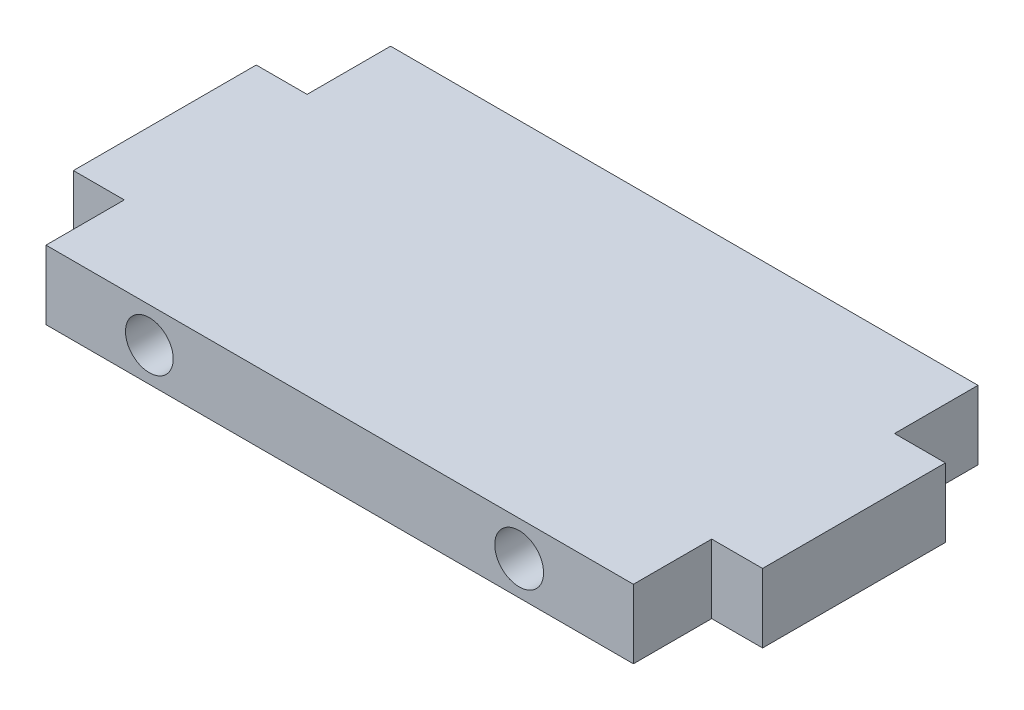
from build123d import *

# Parameters (mm, degrees)
BOSS_EXTRUDE1_DEPTH = 20.32
SKETCH3_W           = 23.583471357
SKETCH3_H           = 24.613240303
SKETCH3_H_2         = 23.081850847
SKETCH3_W_2         = 25.880555541
CUT_EXTRUDE1_DEPTH  = 120.044088604
SKETCH4_R           = 7.199159396
CUT_EXTRUDE2_DEPTH  = 147.168727436
SKETCH5_R           = 7.199159396
SKETCH5_R_2         = 7.039396065
CUT_EXTRUDE4_DEPTH  = 147.168727436


with BuildPart() as part:
    # Sketch2 → Boss-Extrude1 (new body)
    with BuildSketch(Plane(origin=(0, 0, 0), x_dir=(1, 0, 0), z_dir=(0, 1, 0))):
        with BuildLine():
            Line((-85.098911353, 55.935303266), (88.101088647, 55.935303266))
            ThreePointArc((88.101088647, 55.935303266), (98.707690365, 51.541904984), (103.101088647, 40.935303266))
            Line((103.101088647, 40.935303266), (103.101088647, -30.664696734))
            ThreePointArc((103.101088647, -30.664696734), (98.707690365, -41.271298452), (88.101088647, -45.664696734))
            Line((88.101088647, -45.664696734), (-85.098911353, -45.664696734))
            ThreePointArc((-85.098911353, -45.664696734), (-95.705513071, -41.271298452), (-100.098911353, -30.664696734))
            Line((-100.098911353, -30.664696734), (-100.098911353, 40.935303266))
            ThreePointArc((-100.098911353, 40.935303266), (-95.705513071, 51.541904984), (-85.098911353, 55.935303266))
        make_face()
    extrude(amount=-BOSS_EXTRUDE1_DEPTH)

    # Sketch3 → Cut-Extrude1 (cut, through all)
    with BuildSketch(Plane(origin=(0, 0, 0), x_dir=(1, 0, 0), z_dir=(0, 1, 0))):
        with Locations((99.892824326, 43.628683115)):
            Rectangle(SKETCH3_W, SKETCH3_H)
        with Locations((99.892824326, -34.123771311)):
            Rectangle(SKETCH3_W, SKETCH3_H_2)
        with Locations((-98.039189124, 43.628683115)):
            Rectangle(SKETCH3_W_2, SKETCH3_H)
        with Locations((-98.039189124, -34.123771311)):
            Rectangle(SKETCH3_W_2, SKETCH3_H_2)
    extrude(amount=-CUT_EXTRUDE1_DEPTH, mode=Mode.SUBTRACT)

    # Sketch4 → Cut-Extrude2 (cut, through all)
    with BuildSketch(Plane.XY.offset(45.664696734)):
        with Locations((54.410594351, -10.313138946)):
            Circle(SKETCH4_R)
    extrude(amount=-CUT_EXTRUDE2_DEPTH, mode=Mode.SUBTRACT)

    # Sketch5 → Cut-Extrude4 (cut, through all)
    with BuildSketch(Plane.XY.offset(45.664696734)):
        with Locations((54.410594351, -10.313138946)):
            Circle(SKETCH5_R)
        with Locations((-54.624334914, -10.313138946)):
            Circle(SKETCH5_R_2)
    extrude(amount=-CUT_EXTRUDE4_DEPTH, mode=Mode.SUBTRACT)


solid = part.part
